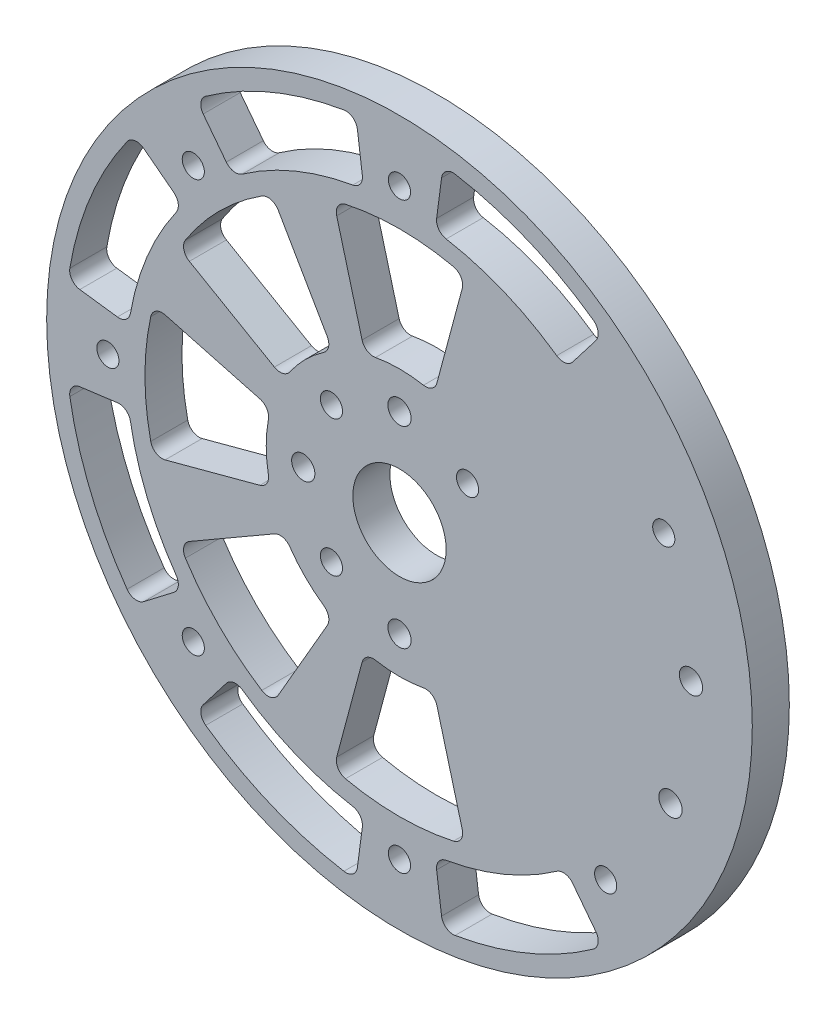
from build123d import *

# Parameters (mm, degrees)
SKETCH1_R                = 60.5
SKETCH1_R_2              = 1.89865
SKETCH1_R_3              = 1.9939
SKETCH1_R_4              = 8
BOSS_EXTRUDE1_DEPTH      = 6.35
CUT_EXTRUDE1_DEPTH       = 86.795235882
FILLET1_R                = 2
CIRPATTERN1_COUNT        = 8
FILLET1_OF_CIRPATTERN1_R = 2
CUT_EXTRUDE2_DEPTH       = 86.795235882
FILLET2_R                = 2
CIRPATTERN3_COUNT        = 8
FILLET2_OF_CIRPATTERN3_R = 2
SKETCH4_R                = 4.7625
SKETCH4_R_2              = 1.89865
CUT_EXTRUDE3_DEPTH       = 3.571875


with BuildPart() as part:
    # Sketch1 → Boss-Extrude1 (new body)
    with BuildSketch(Plane.XY):
        Circle(SKETCH1_R)
        with Locations((45.315389352, 21.130913087)):
            Circle(SKETCH1_R_2, mode=Mode.SUBTRACT)
        with Locations((49.978847504, 1.454235937)):
            Circle(SKETCH1_R_3, mode=Mode.SUBTRACT)
        Circle(SKETCH1_R_4, mode=Mode.SUBTRACT)
        with Locations((46.467376211, -18.460307366)):
            Circle(SKETCH1_R_3, mode=Mode.SUBTRACT)
        with Locations((0, -16.5)):
            Circle(SKETCH1_R_3, mode=Mode.SUBTRACT)
        with Locations((0, -50)):
            Circle(SKETCH1_R_2, mode=Mode.SUBTRACT)
        with Locations((-16.5, 0)):
            Circle(SKETCH1_R_3, mode=Mode.SUBTRACT)
        with Locations((-11.66726189, -11.66726189)):
            Circle(SKETCH1_R_2, mode=Mode.SUBTRACT)
        with Locations((0, 16.5)):
            Circle(SKETCH1_R_3, mode=Mode.SUBTRACT)
        with Locations((-11.66726189, 11.66726189)):
            Circle(SKETCH1_R_2, mode=Mode.SUBTRACT)
        with Locations((11.66726189, 11.66726189)):
            Circle(SKETCH1_R_2, mode=Mode.SUBTRACT)
        with Locations((-35.355339059, -35.355339059)):
            Circle(SKETCH1_R_2, mode=Mode.SUBTRACT)
        with Locations((-50, 0)):
            Circle(SKETCH1_R_2, mode=Mode.SUBTRACT)
        with Locations((-35.355339059, 35.355339059)):
            Circle(SKETCH1_R_2, mode=Mode.SUBTRACT)
        with Locations((0, 50)):
            Circle(SKETCH1_R_2, mode=Mode.SUBTRACT)
        with Locations((35.355339059, -35.355339059)):
            Circle(SKETCH1_R_2, mode=Mode.SUBTRACT)
    extrude(amount=BOSS_EXTRUDE1_DEPTH)

    # Sketch2 → Cut-Extrude1 (cut, through all)
    with BuildSketch(Plane.XY.offset(6.35)):
        with BuildLine():
            Line((-22.071405131, 5.914015181), (-42.162662318, 11.297451319))
            ThreePointArc((-42.162662318, 11.297451319), (-43.65, 0), (-42.162662318, -11.297451319))
            Line((-42.162662318, -11.297451319), (-22.071405131, -5.914015181))
            ThreePointArc((-22.071405131, -5.914015181), (-22.85, 0), (-22.071405131, 5.914015181))
        make_face()
    cut_extrude1 = extrude(amount=-CUT_EXTRUDE1_DEPTH, mode=Mode.SUBTRACT)

    # Fillet1
    fillet1_edges = [part.edges().sort_by_distance(p)[0] for p in [
        (-42.162662318, -11.297451319, 3.175),
        (-42.162662318, 11.297451319, 3.175),
        (-22.071405131, 5.914015181, 3.175),
        (-22.071405131, -5.914015181, 3.175),
    ]]
    fillet(fillet1_edges, radius=FILLET1_R)

    # CirPattern1: Cut-Extrude1 ×8 about axis, 3 skipped
    cirpattern1_axis = Axis((0, 0, 0), (0, 0, -1))
    add([cut_extrude1.rotate(cirpattern1_axis, i * 360 / CIRPATTERN1_COUNT) for i in range(1, CIRPATTERN1_COUNT) if i not in (3, 4, 5)], mode=Mode.SUBTRACT)

    # Fillet1 of CirPattern1
    fillet1_of_cirpattern1_edges = [part.edges().sort_by_distance(p)[0] for p in [
        (-37.802008875, 21.825, 3.175),
        (-21.825, 37.802008875, 3.175),
        (-11.425, 19.788680476, 3.175),
        (-19.788680476, 11.425, 3.175),
        (-11.297451319, 42.162662318, 3.175),
        (11.297451319, 42.162662318, 3.175),
        (5.914015181, 22.071405131, 3.175),
        (-5.914015181, 22.071405131, 3.175),
        (11.297451319, -42.162662318, 3.175),
        (-11.297451319, -42.162662318, 3.175),
        (-5.914015181, -22.071405131, 3.175),
        (5.914015181, -22.071405131, 3.175),
        (-21.825, -37.802008875, 3.175),
        (-37.802008875, -21.825, 3.175),
        (-19.788680476, -11.425, 3.175),
        (-11.425, -19.788680476, 3.175),
    ]]
    fillet(fillet1_of_cirpattern1_edges, radius=FILLET1_OF_CIRPATTERN1_R)

    # Sketch3 → Cut-Extrude2 (cut, through all)
    with BuildSketch(Plane.XY.offset(6.35)):
        with BuildLine():
            Line((-45.478980232, 34.897248918), (-37.148770159, 28.505253913))
            ThreePointArc((-37.148770159, 28.505253913), (-43.26065911, 17.91915172), (-46.424405634, 6.111888951))
            Line((-46.424405634, 6.111888951), (-56.834576678, 7.482413969))
            ThreePointArc((-56.834576678, 7.482413969), (-52.961394201, 21.93732776), (-45.478980232, 34.897248918))
        make_face()
    cut_extrude2 = extrude(amount=-CUT_EXTRUDE2_DEPTH, mode=Mode.SUBTRACT)

    # Fillet2
    fillet2_edges = [part.edges().sort_by_distance(p)[0] for p in [
        (-56.834576678, 7.482413969, 3.175),
        (-45.478980232, 34.897248918, 3.175),
        (-37.148770159, 28.505253913, 3.175),
        (-46.424405634, 6.111888951, 3.175),
    ]]
    fillet(fillet2_edges, radius=FILLET2_R)

    # CirPattern3: Cut-Extrude2 ×8 about axis, 2 skipped
    cirpattern3_axis = Axis((0, 0, 0), (0, 0, -1))
    add([cut_extrude2.rotate(cirpattern3_axis, i * 360 / CIRPATTERN3_COUNT) for i in range(1, CIRPATTERN3_COUNT) if i not in (3, 4)], mode=Mode.SUBTRACT)

    # Fillet2 of CirPattern3
    fillet2_of_cirpattern3_edges = [part.edges().sort_by_distance(p)[0] for p in [
        (-34.897248918, 45.478980232, 3.175),
        (-7.482413969, 56.834576678, 3.175),
        (-6.111888951, 46.424405634, 3.175),
        (-28.505253913, 37.148770159, 3.175),
        (7.482413969, 56.834576678, 3.175),
        (34.897248918, 45.478980232, 3.175),
        (28.505253913, 37.148770159, 3.175),
        (6.111888951, 46.424405634, 3.175),
        (34.897248918, -45.478980232, 3.175),
        (7.482413969, -56.834576678, 3.175),
        (6.111888951, -46.424405634, 3.175),
        (28.505253913, -37.148770159, 3.175),
        (-7.482413969, -56.834576678, 3.175),
        (-34.897248918, -45.478980232, 3.175),
        (-28.505253913, -37.148770159, 3.175),
        (-6.111888951, -46.424405634, 3.175),
        (-45.478980232, -34.897248918, 3.175),
        (-56.834576678, -7.482413969, 3.175),
        (-46.424405634, -6.111888951, 3.175),
        (-37.148770159, -28.505253913, 3.175),
    ]]
    fillet(fillet2_of_cirpattern3_edges, radius=FILLET2_OF_CIRPATTERN3_R)

    # Sketch4 → Cut-Extrude3 (cut)
    # profile 1 of 7: a face of its own
    with BuildSketch(Plane(origin=(0, 0, 0), x_dir=(-1, 0, 0), z_dir=(0, 0, -1))):
        with Locations((0, 50)):
            Circle(SKETCH4_R)
        with Locations((0, 50)):
            Circle(SKETCH4_R_2, mode=Mode.SUBTRACT)
    # profile 2 of 7: a face of its own
    with BuildSketch(Plane(origin=(0, 0, 0), x_dir=(-1, 0, 0), z_dir=(0, 0, -1))):
        with Locations((35.355339059, 35.355339059)):
            Circle(SKETCH4_R)
        with Locations((35.355339059, 35.355339059)):
            Circle(SKETCH4_R_2, mode=Mode.SUBTRACT)
    # profile 3 of 7: a face of its own
    with BuildSketch(Plane(origin=(0, 0, 0), x_dir=(-1, 0, 0), z_dir=(0, 0, -1))):
        with Locations((50, 0)):
            Circle(SKETCH4_R)
        with Locations((50, 0)):
            Circle(SKETCH4_R_2, mode=Mode.SUBTRACT)
    # profile 4 of 7: a face of its own
    with BuildSketch(Plane(origin=(0, 0, 0), x_dir=(-1, 0, 0), z_dir=(0, 0, -1))):
        with Locations((35.355339059, -35.355339059)):
            Circle(SKETCH4_R)
        with Locations((35.355339059, -35.355339059)):
            Circle(SKETCH4_R_2, mode=Mode.SUBTRACT)
    # profile 5 of 7: a face of its own
    with BuildSketch(Plane(origin=(0, 0, 0), x_dir=(-1, 0, 0), z_dir=(0, 0, -1))):
        with Locations((0, -50)):
            Circle(SKETCH4_R)
        with Locations((0, -50)):
            Circle(SKETCH4_R_2, mode=Mode.SUBTRACT)
    # profile 6 of 7: a face of its own
    with BuildSketch(Plane(origin=(0, 0, 0), x_dir=(-1, 0, 0), z_dir=(0, 0, -1))):
        with Locations((-35.355339059, -35.355339059)):
            Circle(SKETCH4_R)
        with Locations((-35.355339059, -35.355339059)):
            Circle(SKETCH4_R_2, mode=Mode.SUBTRACT)
    # profile 7 of 7: a face of its own
    with BuildSketch(Plane(origin=(0, 0, 0), x_dir=(-1, 0, 0), z_dir=(0, 0, -1))):
        with Locations((-45.315389352, 21.130913087)):
            Circle(SKETCH4_R)
        with Locations((-45.315389352, 21.130913087)):
            Circle(SKETCH4_R_2, mode=Mode.SUBTRACT)
    extrude(amount=-CUT_EXTRUDE3_DEPTH, mode=Mode.SUBTRACT)


solid = part.part
